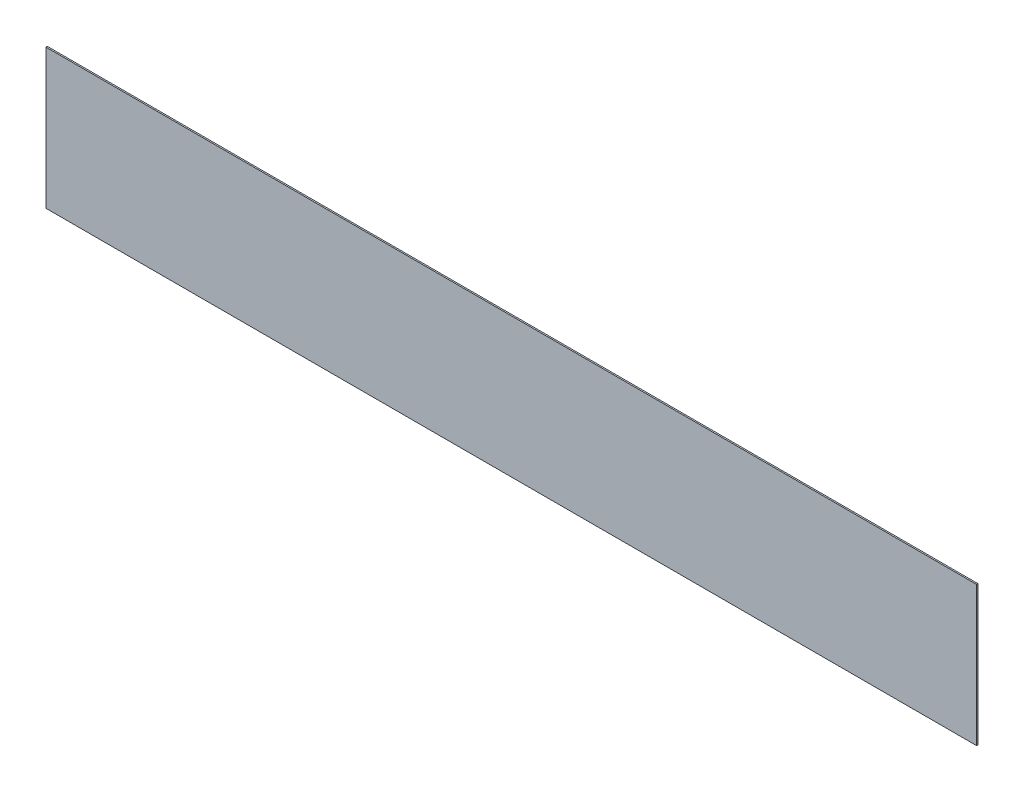
from build123d import *

# Parameters (mm, degrees)
SKETCH1_W           = 200
SKETCH1_H           = 30
BOSS_EXTRUDE1_DEPTH = 0.3


with BuildPart() as part:
    # Sketch1 → Boss-Extrude1 (new body)
    with BuildSketch(Plane.XY):
        Rectangle(SKETCH1_W, SKETCH1_H)
    extrude(amount=BOSS_EXTRUDE1_DEPTH)


solid = part.part
